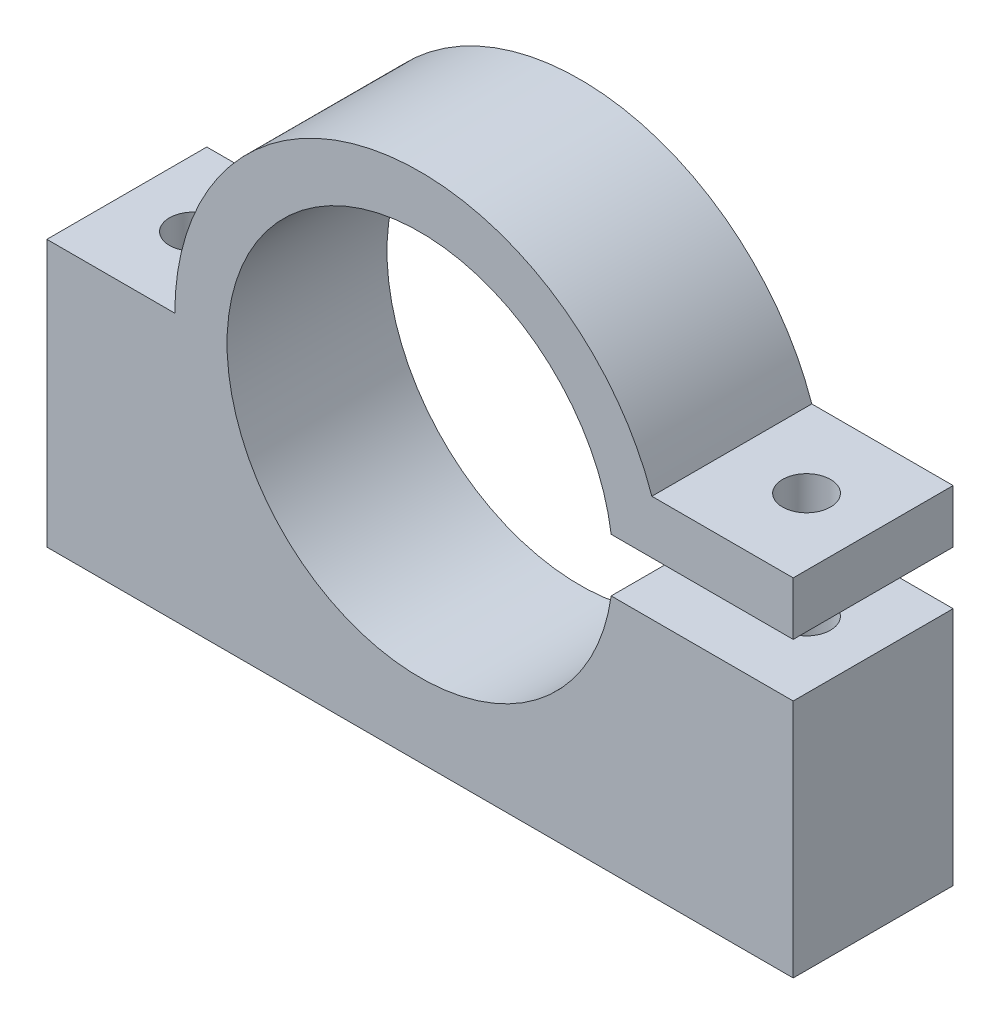
from build123d import *

# Parameters (mm, degrees)
BOSS_EXTRUDE2_DEPTH     = 15
CUT_EXTRUDE3_DEPTH      = 46.552167896
CUT_EXTRUDE3_DEPTH_BACK = 46.552167896
SKETCH4_R               = 2.25


with BuildPart() as part:
    # Sketch1 → Boss-Extrude2 (new body)
    with BuildSketch(Plane.XY):
        with BuildLine():
            ThreePointArc((17.926516672, -2.5), (-1.253006032, -18.056577081), (-18.1, 0))
            Line((-18.1, 0), (-23, 0))
            Line((-23, 0), (-35, 0))
            Line((-35, 0), (-35, -22.5))
            Line((-35, -22.5), (-35, -25))
            Line((-35, -25), (35, -25))
            Line((35, -25), (35, -22.5))
            Line((35, -22.5), (35, -7.5))
            Line((35, -7.5), (35, -2.5))
            Line((35, -2.5), (17.926516672, -2.5))
        make_face()
        with BuildLine():
            Line((17.926516672, 2.5), (35, 2.5))
            Line((35, 2.5), (35, 7.5))
            Line((35, 7.5), (21.742814905, 7.5))
            ThreePointArc((21.742814905, 7.5), (-3.802318844, 22.683526432), (-23, 0))
            Line((-23, 0), (-18.1, 0))
            ThreePointArc((-18.1, 0), (-1.253006032, 18.056577081), (17.926516672, 2.5))
        make_face()
    extrude(amount=BOSS_EXTRUDE2_DEPTH)

    # Sketch4 → Cut-Extrude3 (cut, two sides: drawn at the far end of the back side and taken through both)
    with BuildSketch(Plane(origin=(0, 0, 0), x_dir=(1, 0, 0), z_dir=(0, 1, 0)).offset(-CUT_EXTRUDE3_DEPTH_BACK)):
        with Locations(Location((-28.75, -7.5, 0), (0, 0, 180))):
            Circle(SKETCH4_R)
        with Locations(Location((28.75, -7.5, 0), (0, 0, 180))):
            Circle(SKETCH4_R)
    extrude(amount=CUT_EXTRUDE3_DEPTH + CUT_EXTRUDE3_DEPTH_BACK, mode=Mode.SUBTRACT)


solid = part.part
